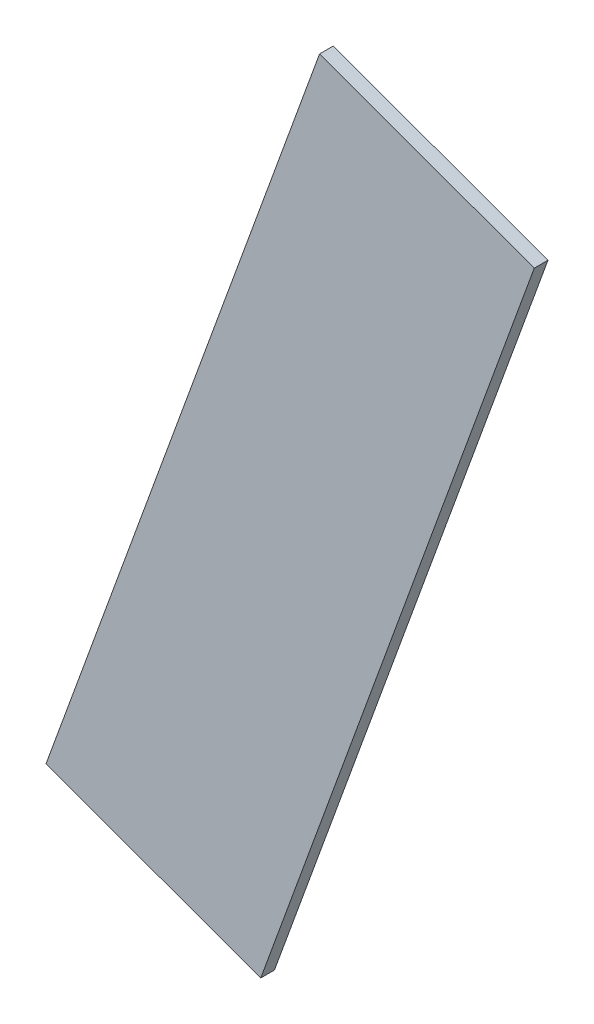
from build123d import *

# Parameters (mm, degrees)
EXTRUDE_1_DEPTH = 3


with BuildPart() as part:
    # 草图1 → 凸台-拉伸1 (new body)
    with BuildSketch(Plane.XY):
        Polygon((366.808331571, 667.065590198), (426.661856653, 831.511798836), (379.677225614, 848.612806002), (319.823700532, 684.166597365), align=None)
    extrude(amount=EXTRUDE_1_DEPTH)


solid = part.part
